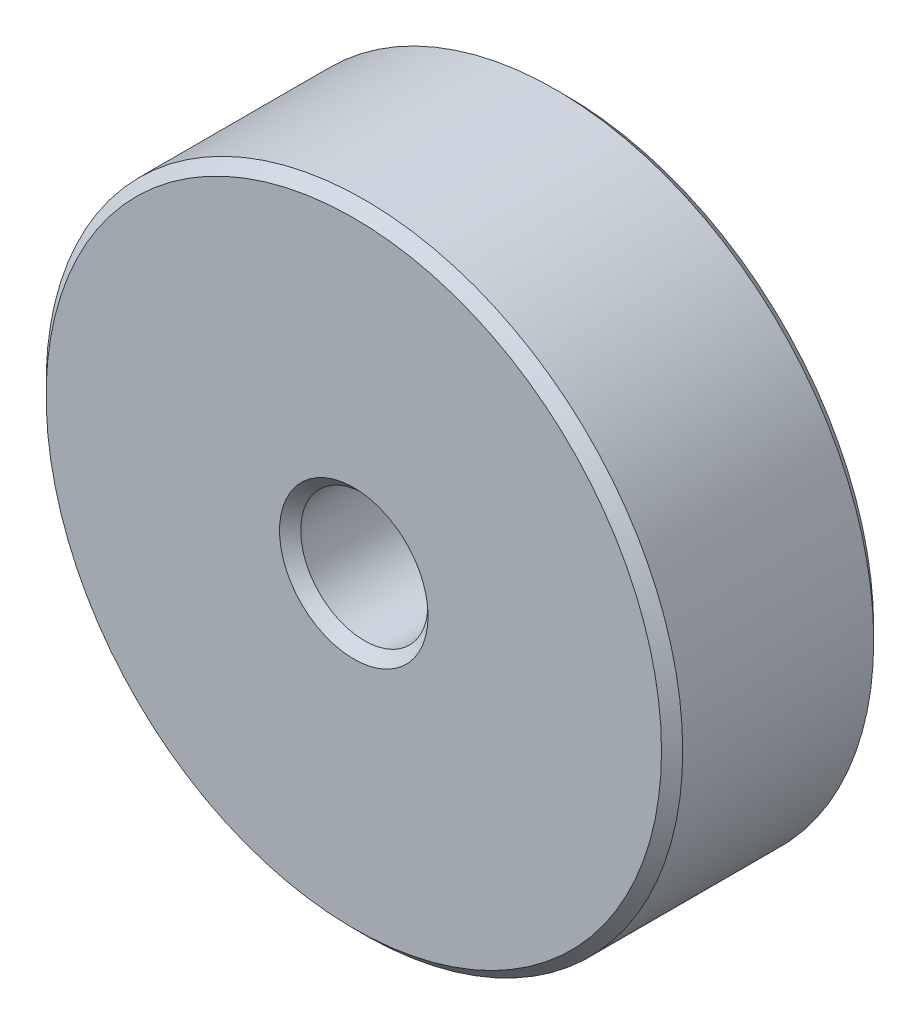
from build123d import *

# Parameters (mm, degrees)
SKETCH1_R           = 15
SKETCH1_R_2         = 3
BOSS_EXTRUDE1_DEPTH = 10
CHAMFER1_SIZE       = 0.5


with BuildPart() as part:
    # Sketch1 → Boss-Extrude1 (new body)
    with BuildSketch(Plane.XY):
        Circle(SKETCH1_R)
        Circle(SKETCH1_R_2, mode=Mode.SUBTRACT)
    extrude(amount=BOSS_EXTRUDE1_DEPTH)

    # Chamfer1
    chamfer1_edges = [part.edges().sort_by_distance(p)[0] for p in [
        (-15, 0, 0),
        (-15, 0, 10),
        (-3, 0, 0),
        (-3, 0, 10),
    ]]
    chamfer(chamfer1_edges, length=CHAMFER1_SIZE)


solid = part.part
